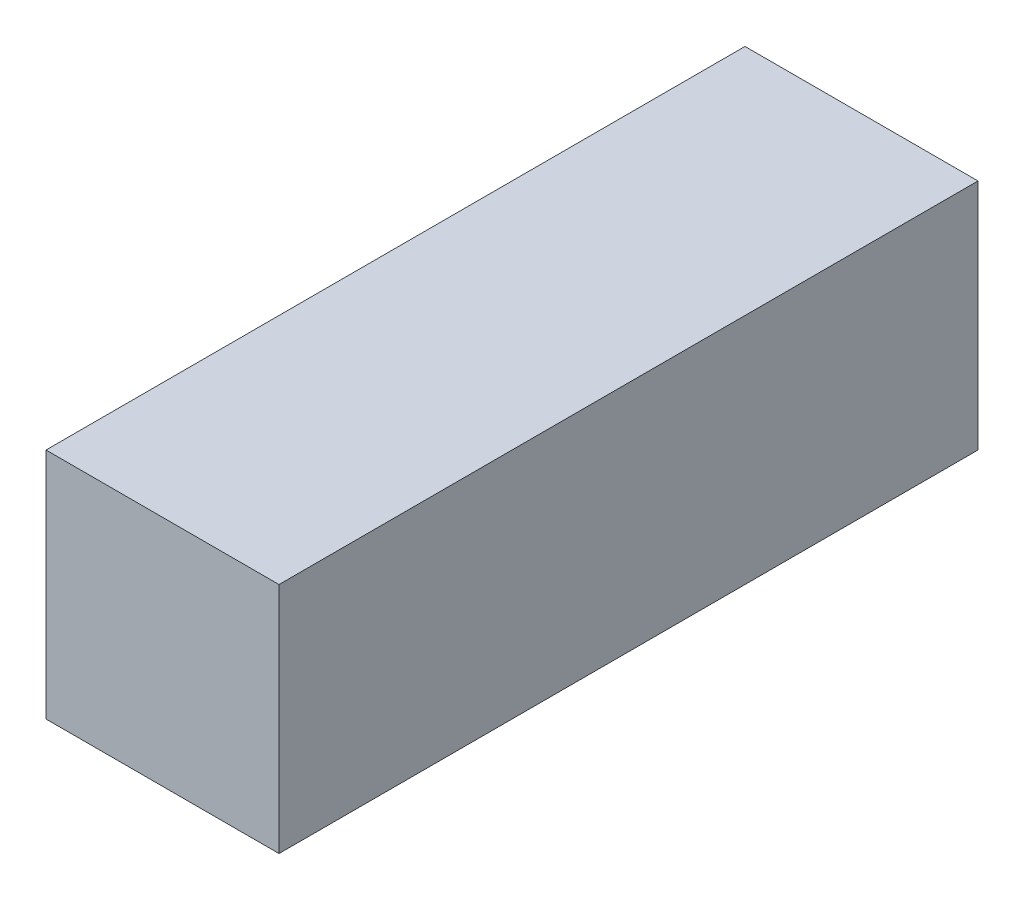
from build123d import *

# Parameters (mm, degrees)
SKETCH1_W           = 20
SKETCH1_H           = 20
BOSS_EXTRUDE1_DEPTH = 60
SKETCH2_R           = 2.6
CUT_EXTRUDE1_DEPTH  = 5


with BuildPart() as part:
    # Sketch1 → Boss-Extrude1 (new body)
    with BuildSketch(Plane.XY):
        with Locations((10, -10)):
            Rectangle(SKETCH1_W, SKETCH1_H)
    extrude(amount=BOSS_EXTRUDE1_DEPTH)

    # Sketch2 → Cut-Extrude1 (cut)
    with BuildSketch(Plane.XZ.offset(20)):
        with Locations(Location((10, 30, 0), (0, 0, 270))):
            Circle(SKETCH2_R)
    extrude(amount=-CUT_EXTRUDE1_DEPTH, mode=Mode.SUBTRACT)


solid = part.part
